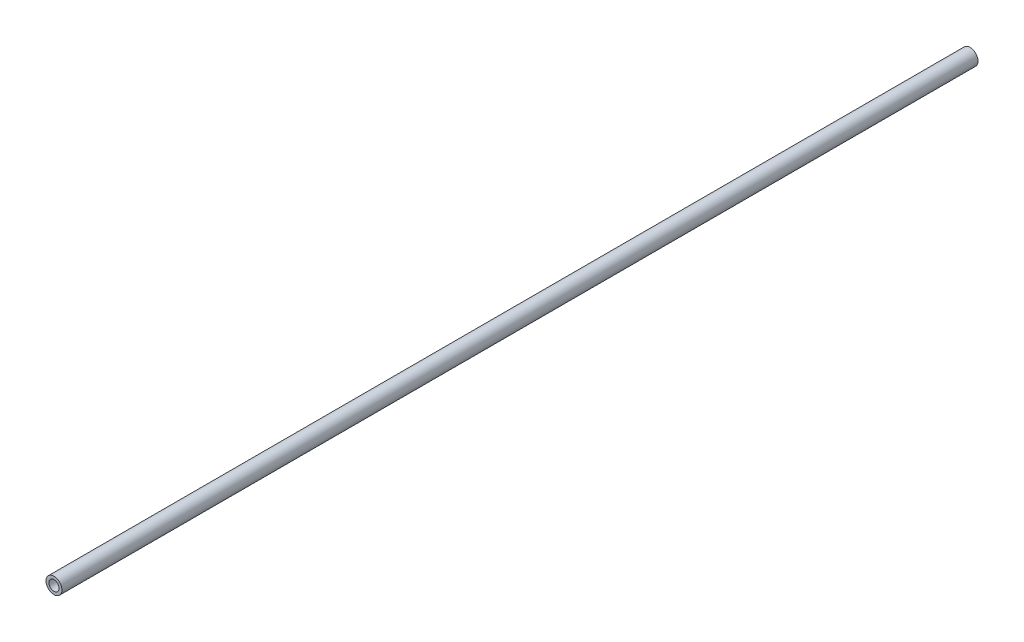
from build123d import *

# Parameters (mm, degrees)
SKETCH1_R           = 2.75
SKETCH1_R_2         = 1.75
BOSS_EXTRUDE1_DEPTH = 316


with BuildPart() as part:
    # Sketch1 → Boss-Extrude1 (new body)
    with BuildSketch(Plane.XY):
        Circle(SKETCH1_R)
        Circle(SKETCH1_R_2, mode=Mode.SUBTRACT)
    extrude(amount=BOSS_EXTRUDE1_DEPTH)


solid = part.part
